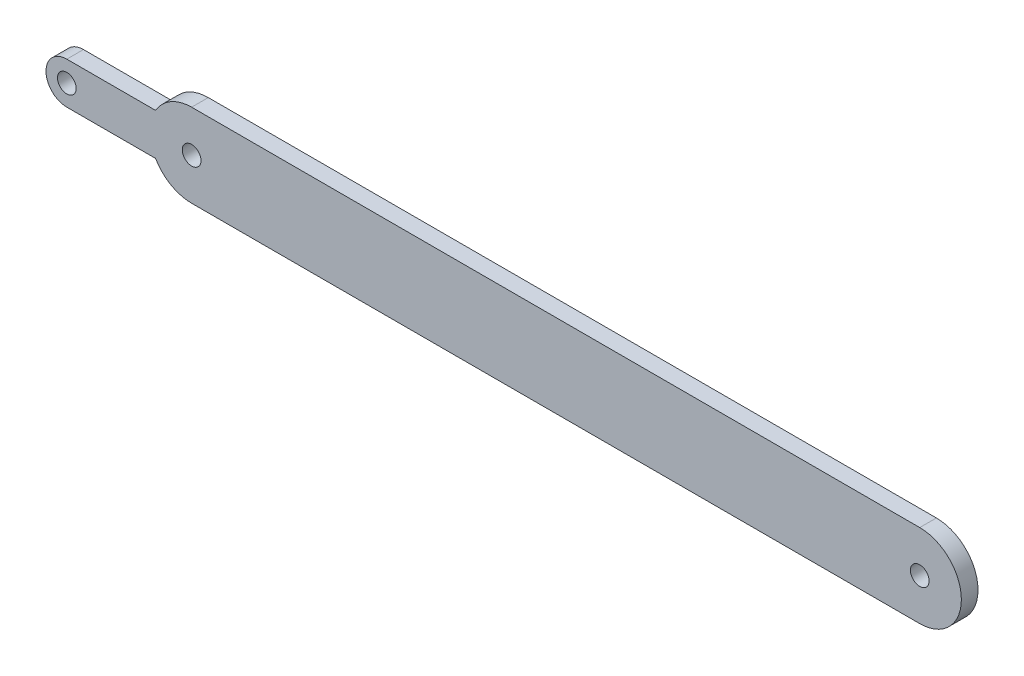
from build123d import *

# Parameters (mm, degrees)
SKETCH1_R           = 2.25
BOSS_EXTRUDE1_DEPTH = 2


with BuildPart() as part:
    # Sketch1 → Boss-Extrude1 (new, symmetric)
    with BuildSketch(Plane.XY):
        with BuildLine():
            Line((0, 10), (175, 10))
            ThreePointArc((175, 10), (185, 0), (175, -10))
            Line((175, -10), (0, -10))
            ThreePointArc((0, -10), (-5.00000204, -8.66025286), (-8.660256393, -4.99999592))
            Line((-8.660256393, -4.99999592), (-30, -5))
            ThreePointArc((-30, -5), (-35, 0), (-30, 5))
            Line((-30, 5), (-8.660256485, 4.999995761))
            ThreePointArc((-8.660256485, 4.999995761), (-5.000002119, 8.660252814), (0, 10))
        make_face()
        Circle(SKETCH1_R, mode=Mode.SUBTRACT)
        with Locations((-30, 0)):
            Circle(SKETCH1_R, mode=Mode.SUBTRACT)
        with Locations((175, 0)):
            Circle(SKETCH1_R, mode=Mode.SUBTRACT)
    extrude(amount=BOSS_EXTRUDE1_DEPTH, both=True)


solid = part.part
